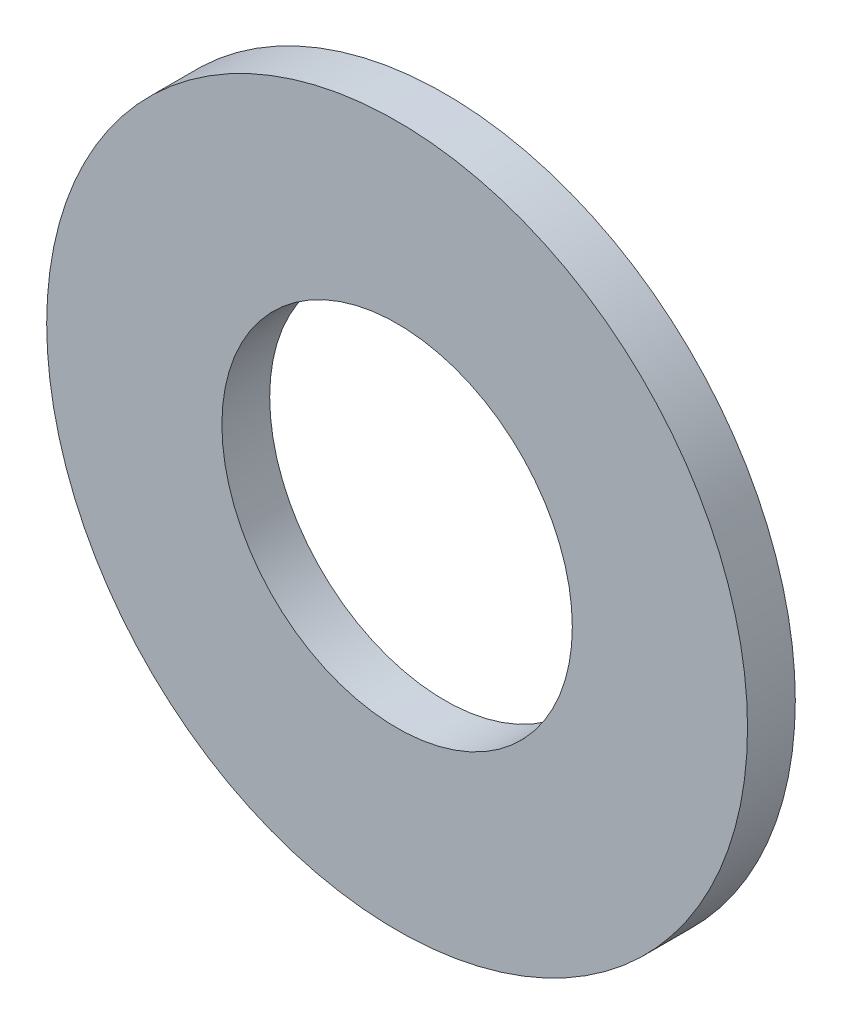
from build123d import *

# Parameters (mm, degrees)
SKETCH1_R      = 11
SKETCH1_R_2    = 5.5
EXTRUDE1_DEPTH = 1.5


with BuildPart() as part:
    # Sketch1 → Extrude1 (new body)
    with BuildSketch(Plane.XY):
        Circle(SKETCH1_R)
        Circle(SKETCH1_R_2, mode=Mode.SUBTRACT)
    extrude(amount=EXTRUDE1_DEPTH)


solid = part.part
